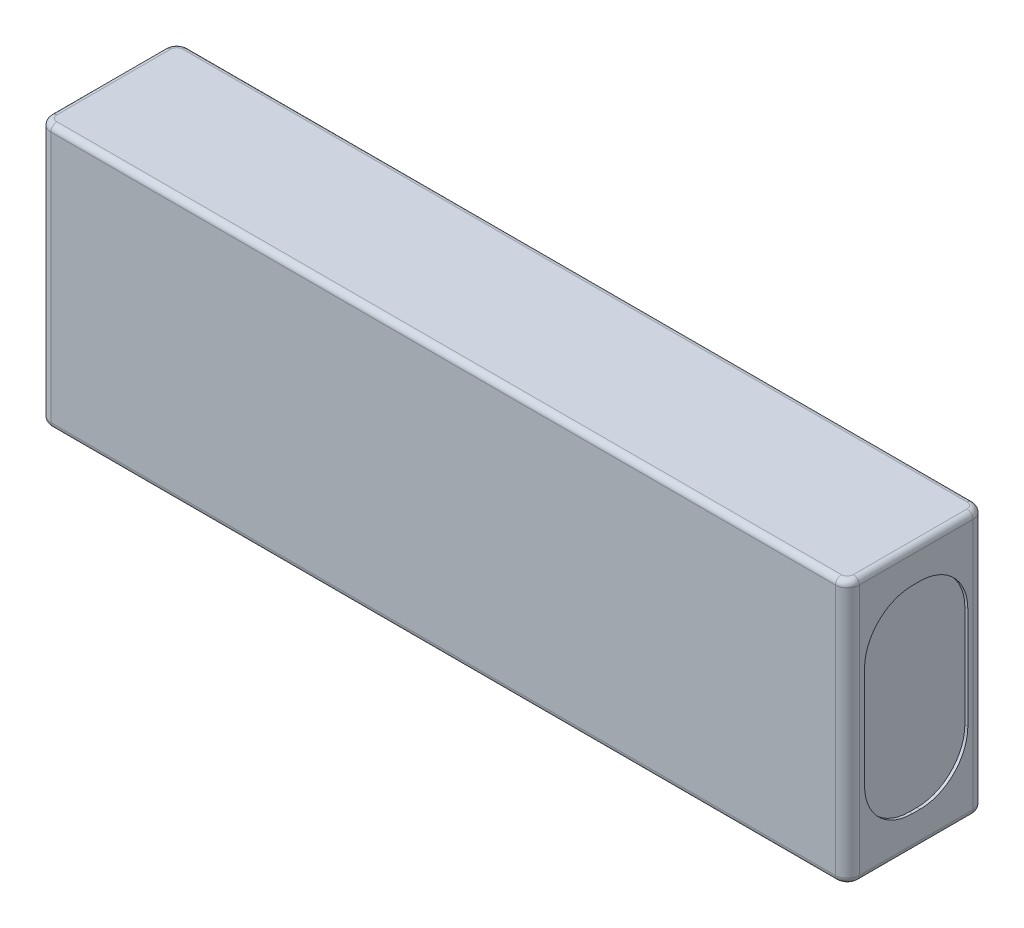
from build123d import *

# Parameters (mm, degrees)
SKETCH1_W           = 135
SKETCH1_H           = 44
BOSS_EXTRUDE1_DEPTH = 23
CUT_EXTRUDE1_DEPTH  = 0.5
CUT_EXTRUDE2_START  = -0.5
CUT_EXTRUDE2_DEPTH  = 0.5
FILLET1_R           = 2
FILLET2_R           = 1


with BuildPart() as part:
    # Sketch1 → Boss-Extrude1 (new body)
    with BuildSketch(Plane(origin=(0, 0, -15), x_dir=(-1, 0, 0), z_dir=(0, 0, -1))):
        with Locations((-1.5, 0)):
            Rectangle(SKETCH1_W, SKETCH1_H)
    extrude(amount=-BOSS_EXTRUDE1_DEPTH)

    # Sketch2 → Cut-Extrude1 (cut)
    with BuildSketch(Plane(origin=(69, 0, 0), x_dir=(0, 0, -1), z_dir=(1, 0, 0))):
        with BuildLine():
            Line((-5.125, 8.5), (-5.125, -8.5))
            ThreePointArc((-5.125, -8.5), (-2.781854249, -14.156854249), (2.875, -16.5))
            Line((2.875, -16.5), (4.125, -16.5))
            ThreePointArc((4.125, -16.5), (9.781854249, -14.156854249), (12.125, -8.5))
            Line((12.125, -8.5), (12.125, 8.5))
            ThreePointArc((12.125, 8.5), (9.781854249, 14.156854249), (4.125, 16.5))
            Line((4.125, 16.5), (2.875, 16.5))
            ThreePointArc((2.875, 16.5), (-2.781854249, 14.156854249), (-5.125, 8.5))
        make_face()
    extrude(amount=-CUT_EXTRUDE1_DEPTH, mode=Mode.SUBTRACT)

    # Sketch3 → Cut-Extrude2 (cut)
    with BuildSketch(Plane.ZY.offset(66).offset(CUT_EXTRUDE2_START)):
        with BuildLine():
            Line((-2.875, 16.5), (-4.125, 16.5))
            ThreePointArc((-4.125, 16.5), (-9.781854249, 14.156854249), (-12.125, 8.5))
            Line((-12.125, 8.5), (-12.125, -8.5))
            ThreePointArc((-12.125, -8.5), (-9.781854249, -14.156854249), (-4.125, -16.5))
            Line((-4.125, -16.5), (-2.875, -16.5))
            ThreePointArc((-2.875, -16.5), (2.781854249, -14.156854249), (5.125, -8.5))
            Line((5.125, -8.5), (5.125, 8.5))
            ThreePointArc((5.125, 8.5), (2.781854249, 14.156854249), (-2.875, 16.5))
        make_face()
    extrude(amount=CUT_EXTRUDE2_DEPTH, mode=Mode.SUBTRACT)

    # Fillet1
    fillet1_edges = [part.edges().sort_by_distance(p)[0] for p in [
        (-66, 0, 8),
        (69, 0, 8),
        (-66, 0, -15),
        (69, 0, -15),
    ]]
    fillet(fillet1_edges, radius=FILLET1_R)

    # Fillet2
    fillet2_edges = [part.edges().sort_by_distance(p)[0] for p in [
        (1.5, -22, -15),
        (1.5, 22, -15),
        (-66, 22, -3.5),
        (1.5, 22, 8),
        (69, 22, -3.5),
        (68.414213562, 22, 7.414213562),
        (68.414213562, 22, -14.414213562),
        (-65.414213562, 22, 7.414213562),
        (-65.414213562, 22, -14.414213562),
        (-66, -22, -3.5),
        (69, -22, -3.5),
        (1.5, -22, 8),
        (68.414213562, -22, 7.414213562),
        (68.414213562, -22, -14.414213562),
        (-65.414213562, -22, 7.414213562),
        (-65.414213562, -22, -14.414213562),
    ]]
    fillet(fillet2_edges, radius=FILLET2_R)


solid = part.part
